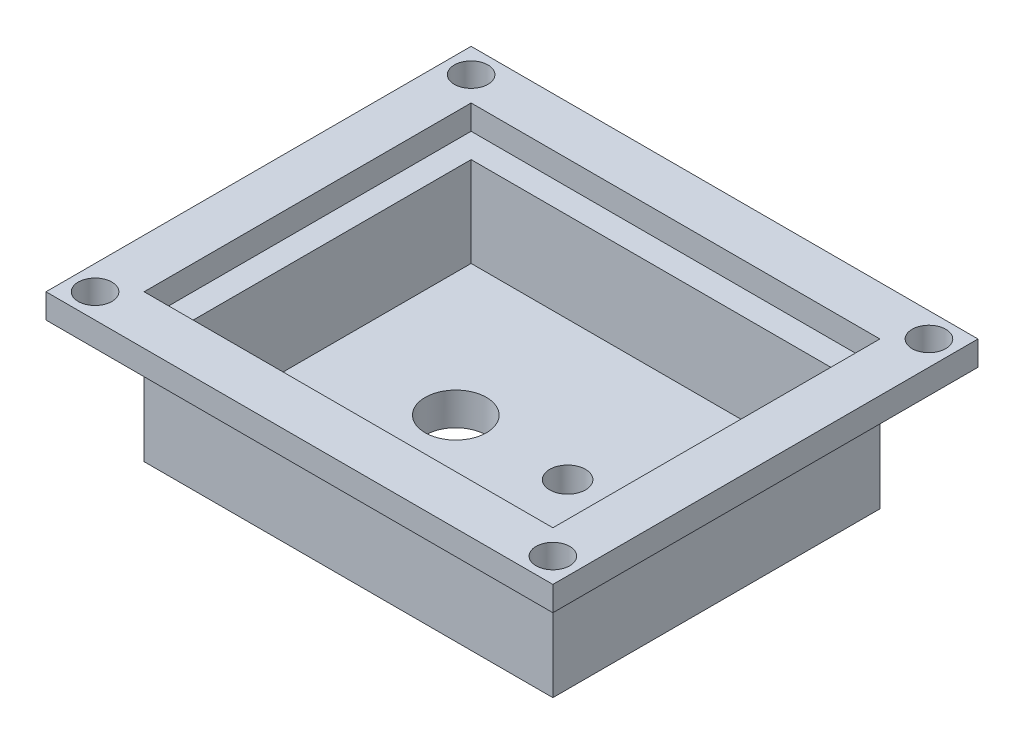
from build123d import *

# Parameters (mm, degrees)
SKETCH1_W                       = 63.5
SKETCH1_H                       = 50.8
BOSS_EXTRUDE1_DEPTH             = 19.05
SKETCH2_W                       = 55.88
SKETCH2_H                       = 43.18
CUT_EXTRUDE1_DEPTH              = 13.97
SKETCH3_R                       = 4.7625
SKETCH3_R_2                     = 2.778125
CUT_EXTRUDE2_DEPTH              = 13.97
SKETCH19_W                      = 78.74
SKETCH19_H                      = 66.04
SKETCH19_W_2                    = 63.5
SKETCH19_H_2                    = 50.8
BOSS_EXTRUDE5_DEPTH             = 3.81
F_10_CLEARANCE_HOLE1_AT_2_COUNT = 2
F_10_CLEARANCE_HOLE1_AT_2_PITCH = 58.42
F_10_CLEARANCE_HOLE1_AT_3_COUNT = 2
F_10_CLEARANCE_HOLE1_AT_3_PITCH = 92.037768335
F_10_CLEARANCE_HOLE1_AT_4_COUNT = 2
F_10_CLEARANCE_HOLE1_AT_4_PITCH = 71.12


with BuildPart() as part:
    # Sketch1 → Boss-Extrude1 (new body)
    with BuildSketch(Plane(origin=(0, 0, 0), x_dir=(1, 0, 0), z_dir=(0, 1, 0))):
        Rectangle(SKETCH1_W, SKETCH1_H)
    extrude(amount=BOSS_EXTRUDE1_DEPTH)

    # Sketch2 → Cut-Extrude1 (cut)
    with BuildSketch(Plane(origin=(0, 19.05, 0), x_dir=(1, 0, 0), z_dir=(0, 1, 0))):
        Rectangle(SKETCH2_W, SKETCH2_H)
    extrude(amount=-CUT_EXTRUDE1_DEPTH, mode=Mode.SUBTRACT)

    # Sketch3 → Cut-Extrude2 (cut)
    with BuildSketch(Plane(origin=(0, 5.08, 0), x_dir=(1, 0, 0), z_dir=(0, 1, 0))):
        with Locations(Location((-8.73125, 0, 0), (0, 0, 270))):
            Circle(SKETCH3_R)
        with Locations(Location((8.636, 0, 0), (0, 0, 270))):
            Circle(SKETCH3_R_2)
    extrude(amount=-CUT_EXTRUDE2_DEPTH, mode=Mode.SUBTRACT)


with BuildPart() as body_2:
    # Sketch19 → Boss-Extrude5 (new body)
    with BuildSketch(Plane(origin=(0, 19.05, 0), x_dir=(1, 0, 0), z_dir=(0, 1, 0))):
        Rectangle(SKETCH19_W, SKETCH19_H)
        Rectangle(SKETCH19_W_2, SKETCH19_H_2, mode=Mode.SUBTRACT)
    extrude(amount=BOSS_EXTRUDE5_DEPTH)

    # Sketch21 → #10 Clearance Hole1 (revolve, cut)
    with BuildSketch(Plane(origin=(35.56, 22.86, -29.21), x_dir=(0, 0, 1), z_dir=(1, 0, 0))):
        Polygon((0, 0), (0, 24.431971551), (2.6162, 22.86), (2.6162, 0), align=None)
    f_10_clearance_hole1 = revolve(axis=Axis((35.56, 29.21, -29.21), (0, -1, 0)), mode=Mode.SUBTRACT)

    # #10 Clearance Hole1 at 2: #10 Clearance Hole1 ×2
    with Locations(*[(0, 0, i * F_10_CLEARANCE_HOLE1_AT_2_PITCH) for i in range(1, F_10_CLEARANCE_HOLE1_AT_2_COUNT)]):
        add(f_10_clearance_hole1, mode=Mode.SUBTRACT)

    # #10 Clearance Hole1 at 3: #10 Clearance Hole1 ×2
    with Locations(*[Vector(-0.7727262545252344, 0, 0.6347394233600139) * (i * F_10_CLEARANCE_HOLE1_AT_3_PITCH) for i in range(1, F_10_CLEARANCE_HOLE1_AT_3_COUNT)]):
        add(f_10_clearance_hole1, mode=Mode.SUBTRACT)

    # #10 Clearance Hole1 at 4: #10 Clearance Hole1 ×2
    with Locations(*[(-i * F_10_CLEARANCE_HOLE1_AT_4_PITCH, 0, 0) for i in range(1, F_10_CLEARANCE_HOLE1_AT_4_COUNT)]):
        add(f_10_clearance_hole1, mode=Mode.SUBTRACT)


solid = Compound([part.part, body_2.part])
